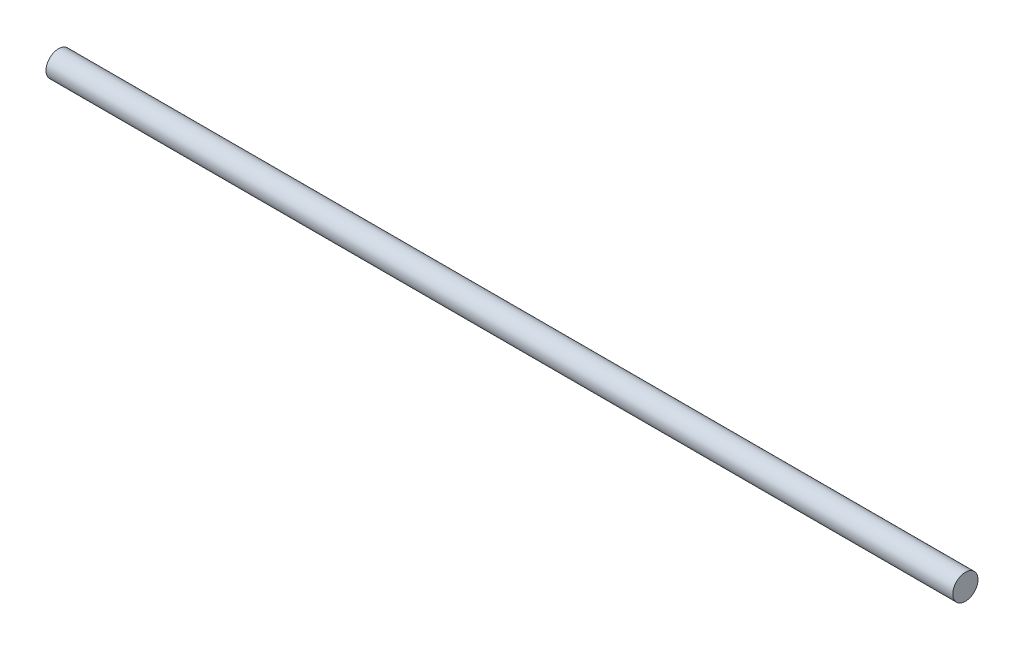
from build123d import *

# Parameters (mm, degrees)
SKETCH1_R           = 3.175
BOSS_EXTRUDE2_DEPTH = 228.6


with BuildPart() as part:
    # Sketch1 → Boss-Extrude2 (new body)
    with BuildSketch(Plane(origin=(0, 0, 0), x_dir=(0, 0, -1), z_dir=(1, 0, 0))):
        Circle(SKETCH1_R)
    extrude(amount=BOSS_EXTRUDE2_DEPTH)


solid = part.part
